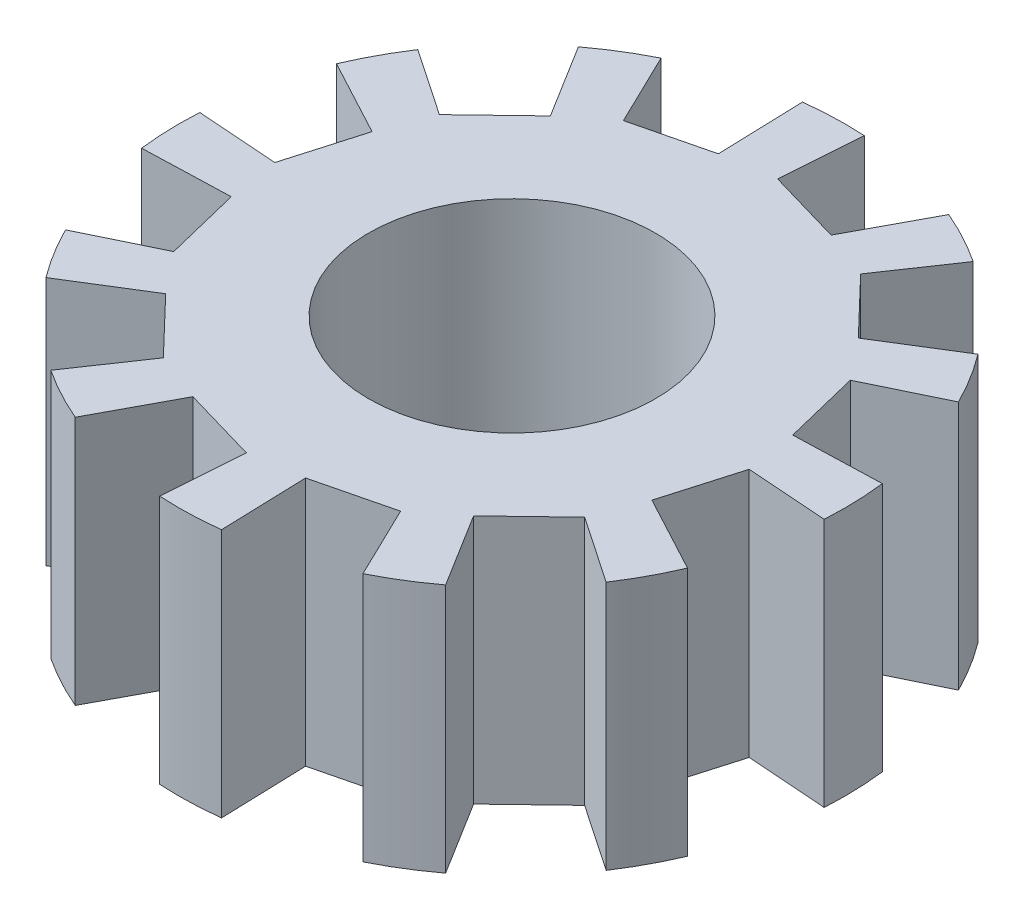
from build123d import *

# Parameters (mm, degrees)
ESQUISSE1_R                  = 6
ESQUISSE1_R_2                = 2.3
BOSS_EXTRU_1_DEPTH           = 4
ENL_V_MAT_EXTRU_1_DEPTH      = 4
ENL_V_MAT_EXTRU_2_DEPTH      = 10
ENL_V_MAT_EXTRU_2_DEPTH_BACK = 10
ESQUISSE3_R                  = 6.951264174
ESQUISSE3_R_2                = 5.333890826


with BuildPart() as part:
    # Esquisse1 → Boss.-Extru.1 (new body)
    with BuildSketch(Plane(origin=(0, 0, 0), x_dir=(1, 0, 0), z_dir=(0, 1, 0))):
        Circle(ESQUISSE1_R)
        Circle(ESQUISSE1_R_2, mode=Mode.SUBTRACT)
    extrude(amount=BOSS_EXTRU_1_DEPTH)

    # Esquisse2 → Enlèv. mat.-Extru.1 (cut)
    with BuildSketch(Plane(origin=(0, 4, 0), x_dir=(1, 0, 0), z_dir=(0, 1, 0))):
        Polygon((0.37038816, 5.988556805), (0.227331291, 4.029155081), (1.435903549, 3.678279264), (2.408685878, 5.495291834), (1.792659416, 6.071810959), align=None)
        Polygon((3.315043958, 5.001048246), (2.211452214, 3.375685011), (3.082668583, 2.467531511), (4.833629077, 3.55471939), (4.588394074, 4.36201283), align=None)
        Polygon((5.371436405, 2.673512847), (3.603016302, 1.817702868), (3.90343506, 0.595610681), (5.963405269, 0.661662757), (6.154672246, 1.483416885), align=None)
        Polygon((5.988556805, -0.37038816), (4.029155081, -0.227331291), (3.678279264, -1.435903549), (5.495291834, -2.408685878), (6.071810959, -1.792659416), align=None)
        Polygon((5.001048246, -3.315043958), (3.375685011, -2.211452214), (2.467531511, -3.082668583), (3.55471939, -4.833629077), (4.36201283, -4.588394074), align=None)
        Polygon((2.673512847, -5.371436405), (1.817702868, -3.603016302), (0.595610681, -3.90343506), (0.661662757, -5.963405269), (1.483416885, -6.154672246), align=None)
        Polygon((-0.37038816, -5.988556805), (-0.227331291, -4.029155081), (-1.435903549, -3.678279264), (-2.408685878, -5.495291834), (-1.792659416, -6.071810959), align=None)
        Polygon((-3.315043958, -5.001048246), (-2.211452214, -3.375685011), (-3.082668583, -2.467531511), (-4.833629077, -3.55471939), (-4.588394074, -4.36201283), align=None)
        Polygon((-5.371436405, -2.673512847), (-3.603016302, -1.817702868), (-3.90343506, -0.595610681), (-5.963405269, -0.661662757), (-6.154672246, -1.483416885), align=None)
        Polygon((-5.988556805, 0.37038816), (-4.029155081, 0.227331291), (-3.678279264, 1.435903549), (-5.495291834, 2.408685878), (-6.071810959, 1.792659416), align=None)
        Polygon((-5.001048246, 3.315043958), (-3.375685011, 2.211452214), (-2.467531511, 3.082668583), (-3.55471939, 4.833629077), (-4.36201283, 4.588394074), align=None)
        Polygon((-2.673512847, 5.371436405), (-1.817702868, 3.603016302), (-0.595610681, 3.90343506), (-0.661662757, 5.963405269), (-1.483416885, 6.154672246), align=None)
    extrude(amount=-ENL_V_MAT_EXTRU_1_DEPTH, mode=Mode.SUBTRACT)

    # Esquisse3 → Enlèv. mat.-Extru.2 (cut, two sides: drawn at the far end of the back side and taken through both)
    with BuildSketch(Plane(origin=(0, 4, 0), x_dir=(1, 0, 0), z_dir=(0, 1, 0)).offset(-ENL_V_MAT_EXTRU_2_DEPTH_BACK)):
        Circle(ESQUISSE3_R)
        Circle(ESQUISSE3_R_2, mode=Mode.SUBTRACT)
    extrude(amount=ENL_V_MAT_EXTRU_2_DEPTH + ENL_V_MAT_EXTRU_2_DEPTH_BACK, mode=Mode.SUBTRACT)


solid = part.part
